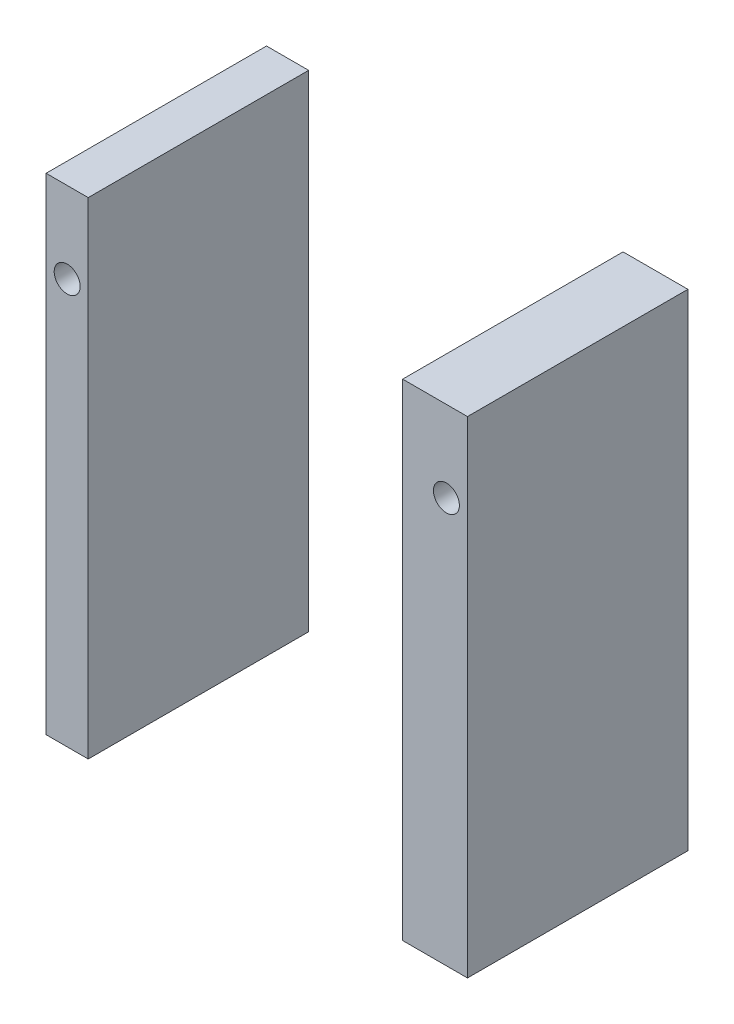
from build123d import *

# Parameters (mm, degrees)
SKETCH2_W             = 3.302
SKETCH2_H             = 38.1
BOSS_EXTRUDE1_DEPTH   = 17.272
SKETCH2_W_2           = 5.08
BOSS_EXTRUDE1_2_DEPTH = 17.272
SKETCH3_R             = 1.016
CUT_EXTRUDE1_DEPTH    = 2.032


with BuildPart() as part:
    # Sketch2 → Boss-Extrude1 (new body)
    with BuildSketch(Plane.XY):
        with Locations((-14.859, 19.05)):
            Rectangle(SKETCH2_W, SKETCH2_H)
    extrude(amount=BOSS_EXTRUDE1_DEPTH)


with BuildPart() as body_2:
    # Sketch2 → Boss-Extrude1 2 (new body)
    with BuildSketch(Plane.XY):
        with Locations((13.97, 19.05)):
            Rectangle(SKETCH2_W_2, SKETCH2_H)
    extrude(amount=BOSS_EXTRUDE1_2_DEPTH)


with BuildPart() as cut_extrude1_tool:
    # Sketch3 → Cut-Extrude1 (new body)
    with BuildSketch(Plane.XY.offset(17.272)):
        with Locations((-14.859, 31.75)):
            Circle(SKETCH3_R)
        with Locations((14.859, 31.75)):
            Circle(SKETCH3_R)
    extrude(amount=-CUT_EXTRUDE1_DEPTH)


with BuildPart() as part_1:
    add(part.part)

    # Cut-Extrude1: cut by cut_extrude1_tool
    add(cut_extrude1_tool.part, mode=Mode.SUBTRACT)


with BuildPart() as body_2_1:
    add(body_2.part)

    # Cut-Extrude1: cut by cut_extrude1_tool
    add(cut_extrude1_tool.part, mode=Mode.SUBTRACT)


solid = Compound([part_1.part, body_2_1.part])
